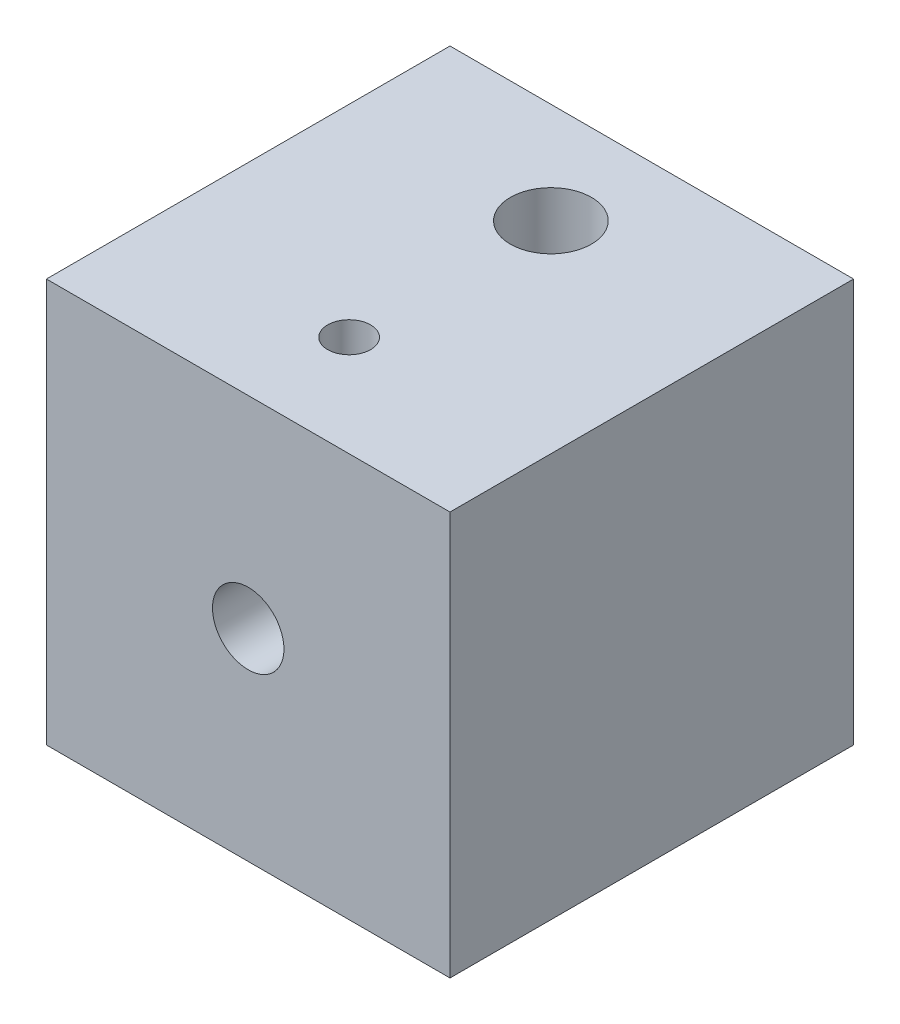
from build123d import *

# Parameters (mm, degrees)
SKETCH1_W                    = 25.4
SKETCH1_H                    = 25.4
BOSS_EXTRUDE1_DEPTH          = 25.4
SKETCH2_R                    = 2.25
CUT_EXTRUDE1_DEPTH           = 12.7
SKETCH3_R                    = 6.985
CUT_EXTRUDE2_DEPTH           = 12.7
F_6_32_TAPPED_HOLE1_REACH    = 33.109
F_6_32_TAPPED_HOLE1_BORE_R   = 1.35255
F_1_4_20_TAPPED_HOLE2_REACH  = 33.109
F_1_4_20_TAPPED_HOLE2_BORE_R = 2.5527


with BuildPart() as part:
    # Sketch1 → Boss-Extrude1 (new body)
    with BuildSketch(Plane(origin=(0, 0, 0), x_dir=(1, 0, 0), z_dir=(0, 1, 0))):
        Rectangle(SKETCH1_W, SKETCH1_H)
    extrude(amount=BOSS_EXTRUDE1_DEPTH)

    # Sketch2 → Cut-Extrude1 (cut)
    with BuildSketch(Plane.XY.offset(12.7)):
        with Locations((0, 12.7)):
            Circle(SKETCH2_R)
    extrude(amount=-CUT_EXTRUDE1_DEPTH, mode=Mode.SUBTRACT)

    # Sketch3 → Cut-Extrude2 (cut)
    with BuildSketch(Plane(origin=(0, 0, -12.7), x_dir=(-1, 0, 0), z_dir=(0, 0, -1))):
        with Locations((0, 12.7)):
            Circle(SKETCH3_R)
    extrude(amount=-CUT_EXTRUDE2_DEPTH, mode=Mode.SUBTRACT)

    # #6-32 Tapped Hole1 bore → #6-32 Tapped Hole1 (cut, up to next)
    with BuildSketch(Plane(origin=(0, 25.4, 0), x_dir=(1, 0, 0), z_dir=(0, 1, 0)), mode=Mode.PRIVATE) as f_6_32_tapped_hole1_sk1:
        with Locations((0, -6.35)):
            Circle(F_6_32_TAPPED_HOLE1_BORE_R)
    f_6_32_tapped_hole1_tool1 = extrude(f_6_32_tapped_hole1_sk1.sketch, amount=-F_6_32_TAPPED_HOLE1_REACH, mode=Mode.PRIVATE) & part.part
    add(f_6_32_tapped_hole1_tool1.solids().sort_by_distance((0, 25.4, 6.35))[0], mode=Mode.SUBTRACT)

    # 1/4-20 Tapped Hole2 bore → 1/4-20 Tapped Hole2 (cut, up to next)
    with BuildSketch(Plane(origin=(0, 25.4, 0), x_dir=(1, 0, 0), z_dir=(0, 1, 0)), mode=Mode.PRIVATE) as f_1_4_20_tapped_hole2_sk1:
        with Locations((0, 6.35)):
            Circle(F_1_4_20_TAPPED_HOLE2_BORE_R)
    f_1_4_20_tapped_hole2_tool1 = extrude(f_1_4_20_tapped_hole2_sk1.sketch, amount=-F_1_4_20_TAPPED_HOLE2_REACH, mode=Mode.PRIVATE) & part.part
    add(f_1_4_20_tapped_hole2_tool1.solids().sort_by_distance((0, 25.4, -6.35))[0], mode=Mode.SUBTRACT)


solid = part.part
